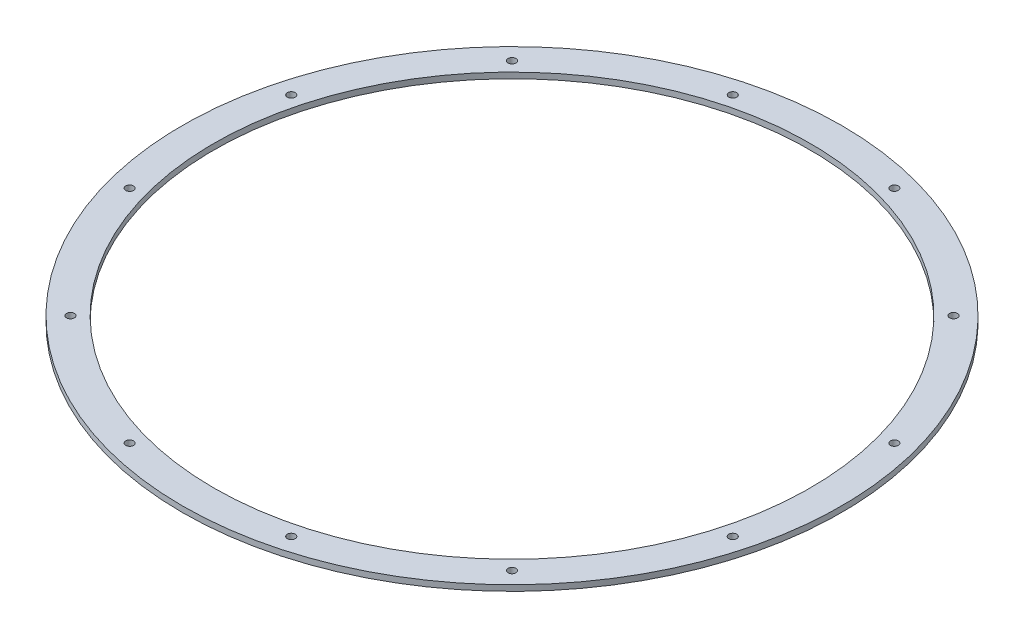
from build123d import *

# Parameters (mm, degrees)
SCHIZZO1_R                   = 258
SCHIZZO1_R_2                 = 3.4
ESTRUSIONE_ESTRUSIONE1_DEPTH = 2.5


with BuildPart() as part:
    # Schizzo1 → Estrusione-Estrusione1 (new, symmetric)
    with BuildSketch(Plane(origin=(0, 0, 0), x_dir=(1, 0, 0), z_dir=(0, 1, 0))):
        with BuildLine():
            ThreePointArc((-285, 0), (0, -285), (285, 0))
            ThreePointArc((285, 0), (0, 285), (-285, 0))
        make_face()
        with Locations(Location((0, 0, 0), (0, 0, 270))):
            Circle(SCHIZZO1_R, mode=Mode.SUBTRACT)
        with Locations(Location((-260.799973098, 69.881142178, 0), (0, 0, 270))):
            Circle(SCHIZZO1_R_2, mode=Mode.SUBTRACT)
        with Locations(Location((-190.91883092, 190.91883092, 0), (0, 0, 270))):
            Circle(SCHIZZO1_R_2, mode=Mode.SUBTRACT)
        with Locations(Location((-69.881142178, 260.799973098, 0), (0, 0, 270))):
            Circle(SCHIZZO1_R_2, mode=Mode.SUBTRACT)
        with Locations(Location((69.881142178, 260.799973098, 0), (0, 0, 270))):
            Circle(SCHIZZO1_R_2, mode=Mode.SUBTRACT)
        with Locations(Location((190.91883092, 190.91883092, 0), (0, 0, 270))):
            Circle(SCHIZZO1_R_2, mode=Mode.SUBTRACT)
        with Locations(Location((260.799973098, 69.881142178, 0), (0, 0, 270))):
            Circle(SCHIZZO1_R_2, mode=Mode.SUBTRACT)
        with Locations(Location((260.799973098, -69.881142178, 0), (0, 0, 270))):
            Circle(SCHIZZO1_R_2, mode=Mode.SUBTRACT)
        with Locations(Location((190.91883092, -190.91883092, 0), (0, 0, 270))):
            Circle(SCHIZZO1_R_2, mode=Mode.SUBTRACT)
        with Locations(Location((69.881142178, -260.799973098, 0), (0, 0, 270))):
            Circle(SCHIZZO1_R_2, mode=Mode.SUBTRACT)
        with Locations(Location((-69.881142178, -260.799973098, 0), (0, 0, 270))):
            Circle(SCHIZZO1_R_2, mode=Mode.SUBTRACT)
        with Locations(Location((-190.91883092, -190.91883092, 0), (0, 0, 270))):
            Circle(SCHIZZO1_R_2, mode=Mode.SUBTRACT)
        with Locations(Location((-260.799973098, -69.881142178, 0), (0, 0, 270))):
            Circle(SCHIZZO1_R_2, mode=Mode.SUBTRACT)
    extrude(amount=ESTRUSIONE_ESTRUSIONE1_DEPTH, both=True)


solid = part.part
